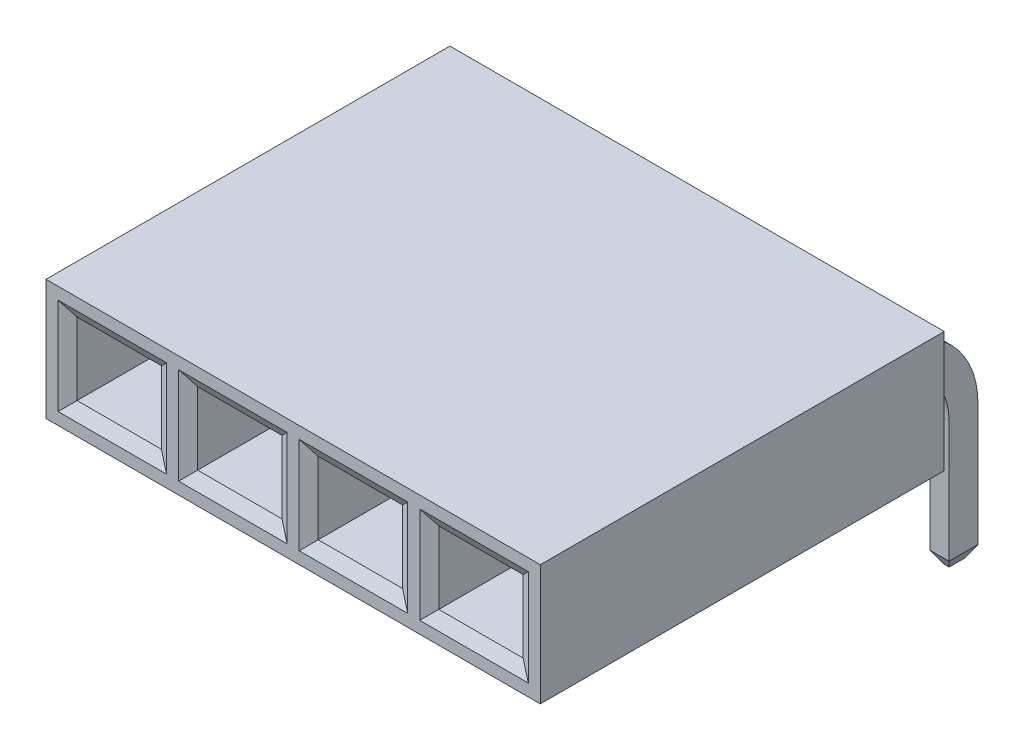
from build123d import *
from OCP.BRepFilletAPI import BRepFilletAPI_MakeChamfer

# Parameters (mm, degrees)
SKETCH1_W                   = 2.794
SKETCH1_H                   = 2.54
BOSS_EXTRUDE1_DEPTH         = 4.2545
SKETCH3_W                   = 0.4064
SKETCH3_H                   = 0.6096
CHAMFER1_SIZE               = 0.254
CHAMFER1_SIZE2              = 0.146646968
SKETCH4_W                   = 1.778
SKETCH4_H                   = 1.524
CUT_EXTRUDE1_DEPTH          = 6.35
CHAMFER2_SIZE               = 0.254
CHAMFER2_SIZE2              = 0.146646968
LPATTERN1_COUNT             = 4
LPATTERN1_PITCH             = 2.54
CHAMFER1_OF_LPATTERN1_SIZE  = 0.254
CHAMFER1_OF_LPATTERN1_SIZE2 = 0.146646968
CHAMFER2_OF_LPATTERN1_SIZE2 = 0.146646968
CHAMFER2_OF_LPATTERN1_SIZE  = 0.254


with BuildPart() as part:
    # Sketch1 → Boss-Extrude1 (new, symmetric)
    with BuildSketch(Plane.XY):
        Rectangle(SKETCH1_W, SKETCH1_H)
    boss_extrude1 = extrude(amount=BOSS_EXTRUDE1_DEPTH, both=True)

    # Sweep1: sweep along a path in Sketch2
    with BuildLine(Plane(origin=(0, 0, 0), x_dir=(0, 0, -1), z_dir=(1, 0, 0))) as sweep1_path:
        Line((5.8547, -4.4196), (5.8547, -1.6002))
        ThreePointArc((5.8547, -1.6002), (5.386012271, -0.468687729), (4.2545, 0))
    # Sketch3 → Sweep1 (sweep)
    with BuildSketch(Plane(origin=(0, 0, -4.2545), x_dir=(-1, 0, 0), z_dir=(0, 0, -1))):
        Rectangle(SKETCH3_W, SKETCH3_H)
    sweep1 = sweep(path=sweep1_path.line)

    # Chamfer1: one chamfer whose edges measure the first distance from different faces: ONE call of the kernel's chamfer builder (chamfer() names one face for all edges)
    chamfer1_edges_1 = [part.edges().sort_by_distance(p)[0] for p in [
        (-0.2032, -4.4196, -5.8547),
    ]]
    chamfer1_side_1 = [part.faces().sort_by_distance(p)[0] for p in [
        (-0.2032, -1.859510613, -5.586438348),
    ]]
    chamfer1_edges_2 = [part.edges().sort_by_distance(p)[0] for p in [
        (0, -4.4196, -6.1595),
    ]]
    chamfer1_side_2 = [part.faces().sort_by_distance(p)[0] for p in [
        (0, -3.0099, -6.1595),
    ]]
    chamfer1_edges_3 = [part.edges().sort_by_distance(p)[0] for p in [
        (0.2032, -4.4196, -5.8547),
    ]]
    chamfer1_side_3 = [part.faces().sort_by_distance(p)[0] for p in [
        (0.2032, -1.859510613, -5.586438348),
    ]]
    chamfer1_edges_4 = [part.edges().sort_by_distance(p)[0] for p in [
        (0, -4.4196, -5.5499),
    ]]
    chamfer1_side_4 = [part.faces().sort_by_distance(p)[0] for p in [
        (0, -3.0099, -5.5499),
    ]]
    chamfer1 = BRepFilletAPI_MakeChamfer(part.part.solid().wrapped)
    for e in chamfer1_edges_1:
        chamfer1.Add(CHAMFER1_SIZE, CHAMFER1_SIZE2, e.wrapped, chamfer1_side_1[0].wrapped)  # the first distance lies on this face
    for e in chamfer1_edges_2:
        chamfer1.Add(CHAMFER1_SIZE, CHAMFER1_SIZE2, e.wrapped, chamfer1_side_2[0].wrapped)  # the first distance lies on this face
    for e in chamfer1_edges_3:
        chamfer1.Add(CHAMFER1_SIZE, CHAMFER1_SIZE2, e.wrapped, chamfer1_side_3[0].wrapped)  # the first distance lies on this face
    for e in chamfer1_edges_4:
        chamfer1.Add(CHAMFER1_SIZE, CHAMFER1_SIZE2, e.wrapped, chamfer1_side_4[0].wrapped)  # the first distance lies on this face
    add(Compound.cast(chamfer1.Shape()), mode=Mode.REPLACE)

    # Sketch4 → Cut-Extrude1 (cut)
    with BuildSketch(Plane.XY.offset(4.2545)):
        Rectangle(SKETCH4_W, SKETCH4_H)
    cut_extrude1 = extrude(amount=-CUT_EXTRUDE1_DEPTH, mode=Mode.SUBTRACT)

    # Chamfer2
    chamfer2_edges = [part.edges().sort_by_distance(p)[0] for p in [
        (0.889, 0, 4.2545),
        (0, 0.762, 4.2545),
        (-0.889, 0, 4.2545),
        (0, -0.762, 4.2545),
    ]]
    chamfer2_side = [part.faces().sort_by_distance(p)[0] for p in [
        (0, -1.232240185, 4.2545),
    ]]
    chamfer(chamfer2_edges, length=CHAMFER2_SIZE, length2=CHAMFER2_SIZE2, reference=chamfer2_side[0])

    # LPattern1: Boss-Extrude1, Sweep1, Cut-Extrude1 ×4
    with Locations(*[(i * LPATTERN1_PITCH, 0, 0) for i in range(1, LPATTERN1_COUNT)]):
        add(boss_extrude1)
        add(sweep1)
        add(cut_extrude1, mode=Mode.SUBTRACT)

    # Chamfer1 of LPattern1: one chamfer whose edges measure the first distance from different faces: ONE call of the kernel's chamfer builder (chamfer() names one face for all edges)
    chamfer1_of_lpattern1_edges_1 = [part.edges().sort_by_distance(p)[0] for p in [
        (2.3368, -4.4196, -5.8547),
    ]]
    chamfer1_of_lpattern1_side_1 = [part.faces().sort_by_distance(p)[0] for p in [
        (2.3368, -1.859510613, -5.586438348),
    ]]
    chamfer1_of_lpattern1_edges_2 = [part.edges().sort_by_distance(p)[0] for p in [
        (2.54, -4.4196, -6.1595),
    ]]
    chamfer1_of_lpattern1_side_2 = [part.faces().sort_by_distance(p)[0] for p in [
        (2.54, -3.0099, -6.1595),
    ]]
    chamfer1_of_lpattern1_edges_3 = [part.edges().sort_by_distance(p)[0] for p in [
        (2.7432, -4.4196, -5.8547),
    ]]
    chamfer1_of_lpattern1_side_3 = [part.faces().sort_by_distance(p)[0] for p in [
        (2.7432, -1.859510613, -5.586438348),
    ]]
    chamfer1_of_lpattern1_edges_4 = [part.edges().sort_by_distance(p)[0] for p in [
        (2.54, -4.4196, -5.5499),
    ]]
    chamfer1_of_lpattern1_side_4 = [part.faces().sort_by_distance(p)[0] for p in [
        (2.54, -3.0099, -5.5499),
    ]]
    chamfer1_of_lpattern1_edges_5 = [part.edges().sort_by_distance(p)[0] for p in [
        (4.8768, -4.4196, -5.8547),
    ]]
    chamfer1_of_lpattern1_side_5 = [part.faces().sort_by_distance(p)[0] for p in [
        (4.8768, -1.859510613, -5.586438348),
    ]]
    chamfer1_of_lpattern1_edges_6 = [part.edges().sort_by_distance(p)[0] for p in [
        (5.08, -4.4196, -6.1595),
    ]]
    chamfer1_of_lpattern1_side_6 = [part.faces().sort_by_distance(p)[0] for p in [
        (5.08, -3.0099, -6.1595),
    ]]
    chamfer1_of_lpattern1_edges_7 = [part.edges().sort_by_distance(p)[0] for p in [
        (5.2832, -4.4196, -5.8547),
    ]]
    chamfer1_of_lpattern1_side_7 = [part.faces().sort_by_distance(p)[0] for p in [
        (5.2832, -1.859510613, -5.586438348),
    ]]
    chamfer1_of_lpattern1_edges_8 = [part.edges().sort_by_distance(p)[0] for p in [
        (5.08, -4.4196, -5.5499),
    ]]
    chamfer1_of_lpattern1_side_8 = [part.faces().sort_by_distance(p)[0] for p in [
        (5.08, -3.0099, -5.5499),
    ]]
    chamfer1_of_lpattern1_edges_9 = [part.edges().sort_by_distance(p)[0] for p in [
        (7.4168, -4.4196, -5.8547),
    ]]
    chamfer1_of_lpattern1_side_9 = [part.faces().sort_by_distance(p)[0] for p in [
        (7.4168, -1.859510613, -5.586438348),
    ]]
    chamfer1_of_lpattern1_edges_10 = [part.edges().sort_by_distance(p)[0] for p in [
        (7.62, -4.4196, -6.1595),
    ]]
    chamfer1_of_lpattern1_side_10 = [part.faces().sort_by_distance(p)[0] for p in [
        (7.62, -3.0099, -6.1595),
    ]]
    chamfer1_of_lpattern1_edges_11 = [part.edges().sort_by_distance(p)[0] for p in [
        (7.8232, -4.4196, -5.8547),
    ]]
    chamfer1_of_lpattern1_side_11 = [part.faces().sort_by_distance(p)[0] for p in [
        (7.8232, -1.859510613, -5.586438348),
    ]]
    chamfer1_of_lpattern1_edges_12 = [part.edges().sort_by_distance(p)[0] for p in [
        (7.62, -4.4196, -5.5499),
    ]]
    chamfer1_of_lpattern1_side_12 = [part.faces().sort_by_distance(p)[0] for p in [
        (7.62, -3.0099, -5.5499),
    ]]
    chamfer1_of_lpattern1 = BRepFilletAPI_MakeChamfer(part.part.solid().wrapped)
    for e in chamfer1_of_lpattern1_edges_1:
        chamfer1_of_lpattern1.Add(CHAMFER1_OF_LPATTERN1_SIZE, CHAMFER1_OF_LPATTERN1_SIZE2, e.wrapped, chamfer1_of_lpattern1_side_1[0].wrapped)  # the first distance lies on this face
    for e in chamfer1_of_lpattern1_edges_2:
        chamfer1_of_lpattern1.Add(CHAMFER1_OF_LPATTERN1_SIZE, CHAMFER1_OF_LPATTERN1_SIZE2, e.wrapped, chamfer1_of_lpattern1_side_2[0].wrapped)  # the first distance lies on this face
    for e in chamfer1_of_lpattern1_edges_3:
        chamfer1_of_lpattern1.Add(CHAMFER1_OF_LPATTERN1_SIZE, CHAMFER1_OF_LPATTERN1_SIZE2, e.wrapped, chamfer1_of_lpattern1_side_3[0].wrapped)  # the first distance lies on this face
    for e in chamfer1_of_lpattern1_edges_4:
        chamfer1_of_lpattern1.Add(CHAMFER1_OF_LPATTERN1_SIZE, CHAMFER1_OF_LPATTERN1_SIZE2, e.wrapped, chamfer1_of_lpattern1_side_4[0].wrapped)  # the first distance lies on this face
    for e in chamfer1_of_lpattern1_edges_5:
        chamfer1_of_lpattern1.Add(CHAMFER1_OF_LPATTERN1_SIZE, CHAMFER1_OF_LPATTERN1_SIZE2, e.wrapped, chamfer1_of_lpattern1_side_5[0].wrapped)  # the first distance lies on this face
    for e in chamfer1_of_lpattern1_edges_6:
        chamfer1_of_lpattern1.Add(CHAMFER1_OF_LPATTERN1_SIZE, CHAMFER1_OF_LPATTERN1_SIZE2, e.wrapped, chamfer1_of_lpattern1_side_6[0].wrapped)  # the first distance lies on this face
    for e in chamfer1_of_lpattern1_edges_7:
        chamfer1_of_lpattern1.Add(CHAMFER1_OF_LPATTERN1_SIZE, CHAMFER1_OF_LPATTERN1_SIZE2, e.wrapped, chamfer1_of_lpattern1_side_7[0].wrapped)  # the first distance lies on this face
    for e in chamfer1_of_lpattern1_edges_8:
        chamfer1_of_lpattern1.Add(CHAMFER1_OF_LPATTERN1_SIZE, CHAMFER1_OF_LPATTERN1_SIZE2, e.wrapped, chamfer1_of_lpattern1_side_8[0].wrapped)  # the first distance lies on this face
    for e in chamfer1_of_lpattern1_edges_9:
        chamfer1_of_lpattern1.Add(CHAMFER1_OF_LPATTERN1_SIZE, CHAMFER1_OF_LPATTERN1_SIZE2, e.wrapped, chamfer1_of_lpattern1_side_9[0].wrapped)  # the first distance lies on this face
    for e in chamfer1_of_lpattern1_edges_10:
        chamfer1_of_lpattern1.Add(CHAMFER1_OF_LPATTERN1_SIZE, CHAMFER1_OF_LPATTERN1_SIZE2, e.wrapped, chamfer1_of_lpattern1_side_10[0].wrapped)  # the first distance lies on this face
    for e in chamfer1_of_lpattern1_edges_11:
        chamfer1_of_lpattern1.Add(CHAMFER1_OF_LPATTERN1_SIZE, CHAMFER1_OF_LPATTERN1_SIZE2, e.wrapped, chamfer1_of_lpattern1_side_11[0].wrapped)  # the first distance lies on this face
    for e in chamfer1_of_lpattern1_edges_12:
        chamfer1_of_lpattern1.Add(CHAMFER1_OF_LPATTERN1_SIZE, CHAMFER1_OF_LPATTERN1_SIZE2, e.wrapped, chamfer1_of_lpattern1_side_12[0].wrapped)  # the first distance lies on this face
    add(Compound.cast(chamfer1_of_lpattern1.Shape()), mode=Mode.REPLACE)

    # Chamfer2 of LPattern1
    chamfer2_of_lpattern1_edges = [part.edges().sort_by_distance(p)[0] for p in [
        (3.429, 0, 4.2545),
        (2.54, 0.762, 4.2545),
        (1.651, 0, 4.2545),
        (2.54, -0.762, 4.2545),
        (5.969, 0, 4.2545),
        (5.08, 0.762, 4.2545),
        (4.191, 0, 4.2545),
        (5.08, -0.762, 4.2545),
        (8.509, 0, 4.2545),
        (7.62, 0.762, 4.2545),
        (6.731, 0, 4.2545),
        (7.62, -0.762, 4.2545),
    ]]
    chamfer(chamfer2_of_lpattern1_edges, length=CHAMFER2_OF_LPATTERN1_SIZE, length2=CHAMFER2_OF_LPATTERN1_SIZE2)


solid = part.part
